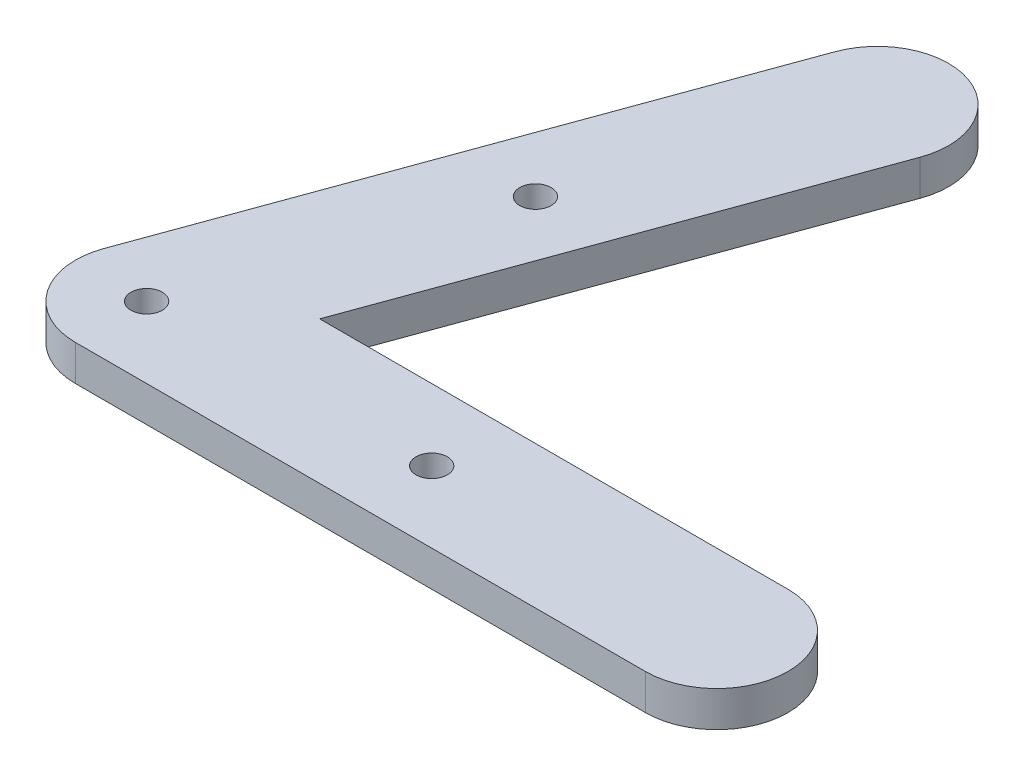
from build123d import *

# Parameters (mm, degrees)
SKETCH5_R            = 2.794
BOSS_EXTRUDE21_DEPTH = 6.35
SKETCH6_R            = 2.794
CUT_EXTRUDE3_DEPTH   = 6.35


with BuildPart() as part:
    # Sketch5 → Boss-Extrude21 (new body)
    # profile 1 of 3: a face of its own
    with BuildSketch(Plane(origin=(0, 0, 0), x_dir=(1, 0, 0), z_dir=(0, 1, 0))):
        with BuildLine():
            Line((101.6, 12.7), (18.137479686, 12.7))
            Line((18.137479686, 12.7), (11.934096284, -4.34365582))
            ThreePointArc((11.934096284, -4.34365582), (7.284420742, -10.403230962), (0, -12.7))
            Line((0, -12.7), (101.6, -12.7))
            ThreePointArc((101.6, -12.7), (114.3, 0), (101.6, 12.7))
        make_face()
    # profile 2 of 3: a face of its own
    with BuildSketch(Plane(origin=(0, 0, 0), x_dir=(1, 0, 0), z_dir=(0, 1, 0))):
        with BuildLine():
            ThreePointArc((-11.934096284, 4.34365582), (-7.284420742, 10.403230962), (0, 12.7))
            Line((0, 12.7), (18.137479686, 12.7))
            Line((18.137479686, 12.7), (46.683342846, 91.129114452))
            ThreePointArc((46.683342846, 91.129114452), (39.092902382, 107.406866556), (22.815150278, 99.816426092))
            Line((22.815150278, 99.816426092), (-11.934096284, 4.34365582))
        make_face()
    # profile 3 of 3: a face of its own
    with BuildSketch(Plane(origin=(0, 0, 0), x_dir=(1, 0, 0), z_dir=(0, 1, 0))):
        with BuildLine():
            Line((18.137479686, 12.7), (0, 12.7))
            ThreePointArc((0, 12.7), (-7.284420742, 10.403230962), (-11.934096284, 4.34365582))
            ThreePointArc((-11.934096284, 4.34365582), (-10.403230962, -7.284420742), (0, -12.7))
            ThreePointArc((0, -12.7), (7.284420742, -10.403230962), (11.934096284, -4.34365582))
            Line((11.934096284, -4.34365582), (18.137479686, 12.7))
        make_face()
        with Locations(Location((0, 0, 0), (0, 0, 270))):
            Circle(SKETCH5_R, mode=Mode.SUBTRACT)
    extrude(amount=BOSS_EXTRUDE21_DEPTH)

    # Sketch6 → Cut-Extrude3 (cut)
    with BuildSketch(Plane(origin=(0, 0, 0), x_dir=(-1, 0, 0), z_dir=(0, -1, 0))):
        with Locations(Location((-50.8, 0, 0), (0, 0, 90))):
            Circle(SKETCH6_R)
        with Locations(Location((-18.489687901, 50.8, 0), (0, 0, 90))):
            Circle(SKETCH6_R)
    extrude(amount=-CUT_EXTRUDE3_DEPTH, mode=Mode.SUBTRACT)


solid = part.part
